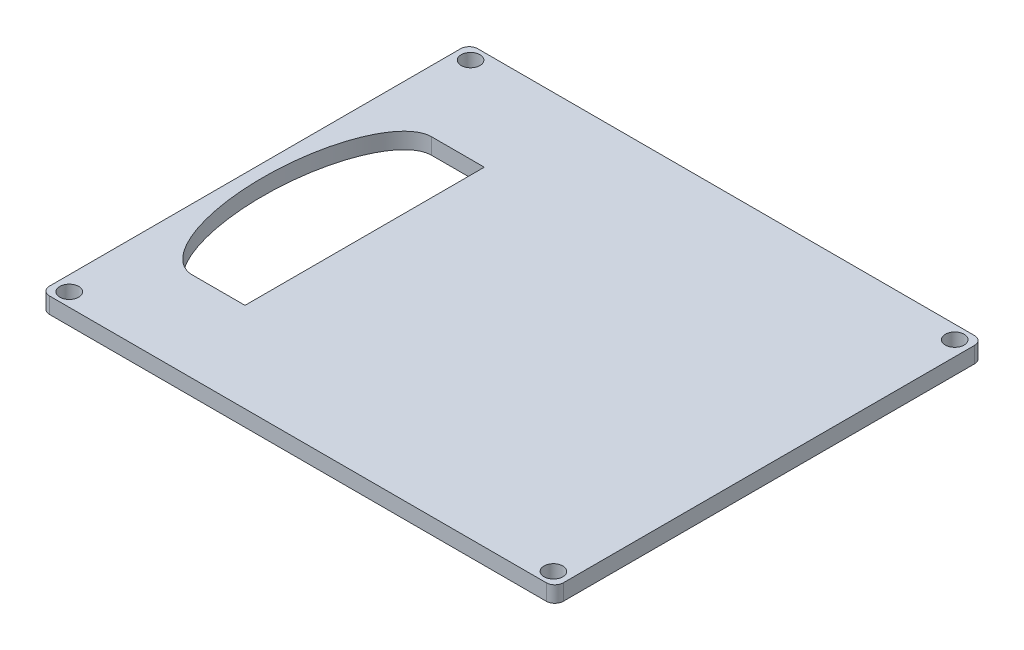
from build123d import *

# Parameters (mm, degrees)
SKETCH1_W           = 152.4
SKETCH1_H           = 127
BOSS_EXTRUDE1_DEPTH = 4.7625
SKETCH2_R           = 2.794
CUT_EXTRUDE1_DEPTH  = 100.304437999
FILLET1_R           = 2.54
SKETCH4_W           = 15.599974926
SKETCH4_H           = 70.968900013
CUT_EXTRUDE2_DEPTH  = 100.304437999
SKETCH5_RX          = 35.484450006
SKETCH5_RY          = 14.605
CUT_EXTRUDE3_DEPTH  = 100.304437999


with BuildPart() as part:
    # Sketch1 → Boss-Extrude1 (new body)
    with BuildSketch(Plane(origin=(0, 0, 0), x_dir=(1, 0, 0), z_dir=(0, 1, 0))):
        Rectangle(SKETCH1_W, SKETCH1_H)
    extrude(amount=BOSS_EXTRUDE1_DEPTH)

    # Sketch2 → Cut-Extrude1 (cut, through all)
    with BuildSketch(Plane(origin=(0, 4.7625, 0), x_dir=(1, 0, 0), z_dir=(0, 1, 0))):
        with Locations(Location((71.794813785, -59.510435834, 0), (0, 0, 270))):
            Circle(SKETCH2_R)
        with Locations(Location((71.794813785, 59.510435834, 0), (0, 0, 270))):
            Circle(SKETCH2_R)
    cut_extrude1 = extrude(amount=-CUT_EXTRUDE1_DEPTH, mode=Mode.SUBTRACT)

    # Mirror1: Cut-Extrude1 across plane
    add(cut_extrude1.mirror(Plane(origin=(0, 0, 0), x_dir=(0, 0, 1), z_dir=(1, 0, 0))), mode=Mode.SUBTRACT)

    # Fillet1
    fillet1_edges = [part.edges().sort_by_distance(p)[0] for p in [
        (76.2, 2.38125, 63.5),
        (-76.2, 2.38125, 63.5),
        (-76.2, 2.38125, -63.5),
        (76.2, 2.38125, -63.5),
    ]]
    fillet(fillet1_edges, radius=FILLET1_R)

    # Sketch4 → Cut-Extrude2 (cut, through all)
    with BuildSketch(Plane(origin=(0, 4.7625, 0), x_dir=(1, 0, 0), z_dir=(0, 1, 0))):
        with Locations((-50.05790393, -1.440073651)):
            Rectangle(SKETCH4_W, SKETCH4_H)
    extrude(amount=-CUT_EXTRUDE2_DEPTH, mode=Mode.SUBTRACT)

    # Sketch5 → Cut-Extrude3 (cut, through all)
    with BuildSketch(Plane(origin=(0, 4.7625, 0), x_dir=(1, 0, 0), z_dir=(0, 1, 0))):
        with Locations(Location((-57.857891393, -1.44007365), (0, 0, -90))):
            Ellipse(SKETCH5_RX, SKETCH5_RY)
    extrude(amount=-CUT_EXTRUDE3_DEPTH, mode=Mode.SUBTRACT)


solid = part.part
